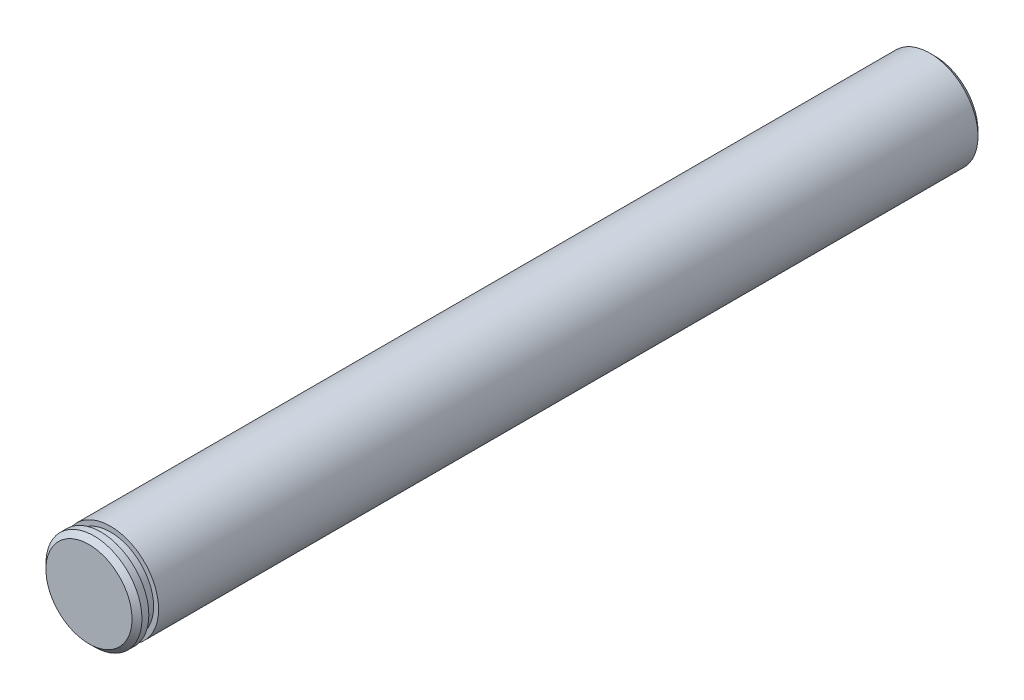
from build123d import *

# Parameters (mm, degrees)
SKETCH1_R           = 4.825
BOSS_EXTRUDE1_DEPTH = 85
CHAMFER1_SIZE       = 0.5
CHAMFER2_SIZE       = 0.5
SKETCH2_W           = 0.5
SKETCH2_H           = 0.98


with BuildPart() as part:
    # Sketch1 → Boss-Extrude1 (new body)
    with BuildSketch(Plane.XY):
        Circle(SKETCH1_R)
    extrude(amount=BOSS_EXTRUDE1_DEPTH)

    # Chamfer1
    chamfer1_edges = [part.edges().sort_by_distance(p)[0] for p in [
        (-4.825, 0, 85),
    ]]
    chamfer(chamfer1_edges, length=CHAMFER1_SIZE)

    # Chamfer2
    chamfer2_edges = [part.edges().sort_by_distance(p)[0] for p in [
        (-4.825, 0, 0),
    ]]
    chamfer(chamfer2_edges, length=CHAMFER2_SIZE)

    # Sketch2 → Cut-Revolve1 (revolve, cut)
    with BuildSketch(Plane(origin=(0, 0, 0), x_dir=(1, 0, 0), z_dir=(0, 1, 0)), mode=Mode.PRIVATE) as cut_revolve1_sk:
        with Locations((-4.575, -83.32)):
            Rectangle(SKETCH2_W, SKETCH2_H)
    revolve(cut_revolve1_sk.sketch.rotate(Axis((0, 0, 85), (0, 0, -1)), 180), axis=Axis((0, 0, 85), (0, 0, -1)), mode=Mode.SUBTRACT)


solid = part.part
